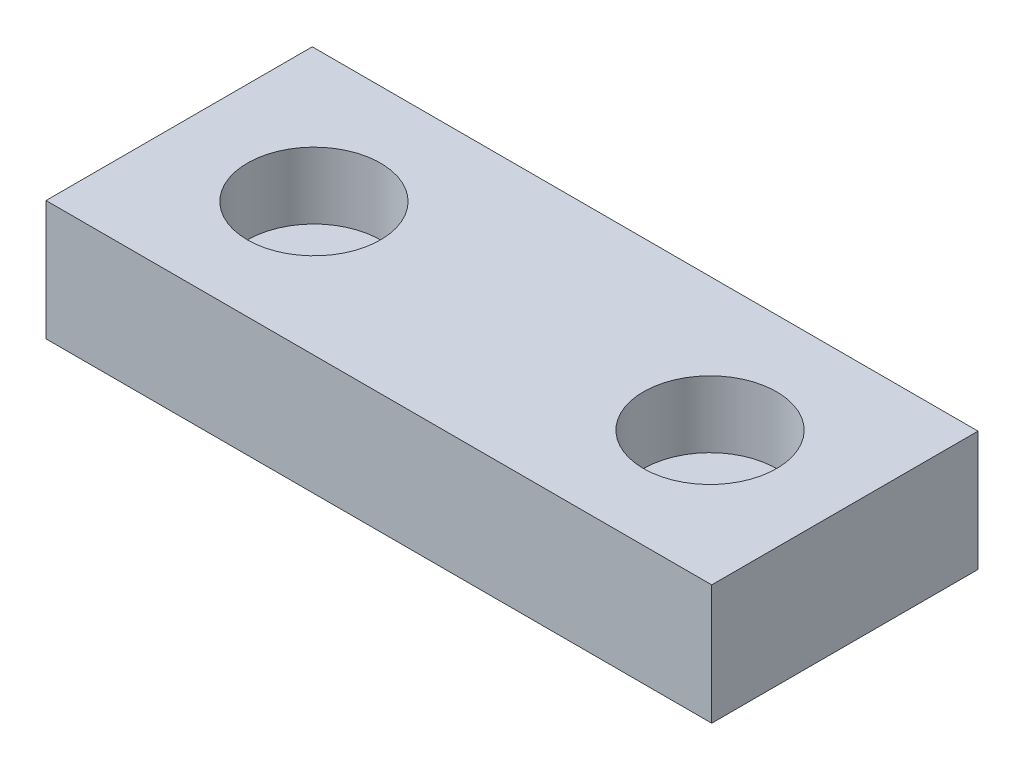
from build123d import *

# Parameters (mm, degrees)
SKETCH1_W           = 100
SKETCH1_H           = 40
BOSS_EXTRUDE1_DEPTH = 18
SKETCH3_R           = 10
CUT_EXTRUDE1_DEPTH  = 10


with BuildPart() as part:
    # Sketch1 → Boss-Extrude1 (new body)
    with BuildSketch(Plane(origin=(0, 0, 0), x_dir=(1, 0, 0), z_dir=(0, 1, 0))):
        Rectangle(SKETCH1_W, SKETCH1_H)
    extrude(amount=BOSS_EXTRUDE1_DEPTH)

    # Sketch3 → Cut-Extrude1 (cut)
    with BuildSketch(Plane(origin=(0, 18, 0), x_dir=(1, 0, 0), z_dir=(0, 1, 0))):
        with Locations(Location((-29.75, 0, 0), (0, 0, 270))):
            Circle(SKETCH3_R)
        with Locations(Location((29.75, 0, 0), (0, 0, 270))):
            Circle(SKETCH3_R)
    extrude(amount=-CUT_EXTRUDE1_DEPTH, mode=Mode.SUBTRACT)


solid = part.part
